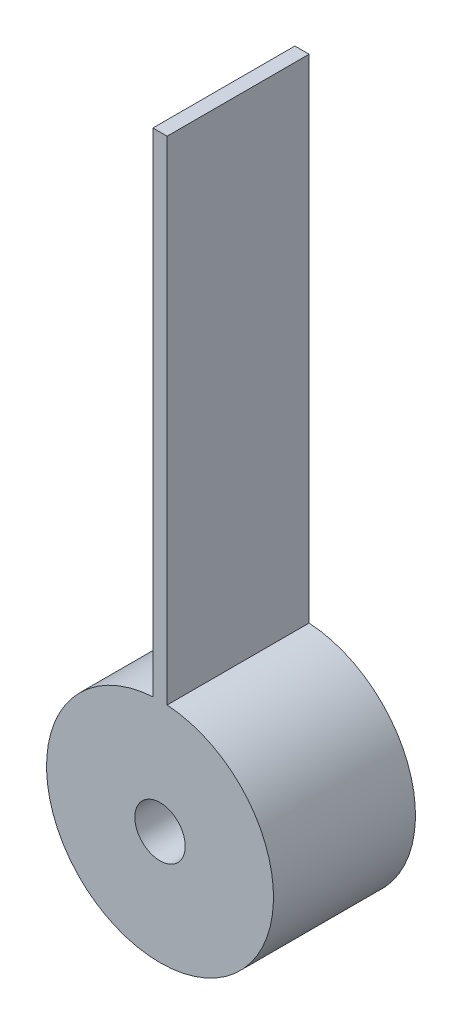
from build123d import *

# Parameters (mm, degrees)
EXTRUDE_1_DEPTH = 10


with BuildPart() as part:
    # Model → 凸台-拉伸1 (new body)
    # profile 1 of 8: a face of its own
    with BuildSketch(Plane.XY):
        with BuildLine():
            ThreePointArc((84.515747624, 134.670602669), (84.656484575, 136.354704261), (86.142958351, 137.15869479))
            Line((86.142958351, 137.15869479), (86.142958351, 143.375196939))
            ThreePointArc((86.142958351, 143.375196939), (85.892835846, 143.371282304), (85.642958351, 143.359542231))
            ThreePointArc((85.642958351, 143.359542231), (79.336442428, 139.572267895), (78.795813778, 132.235830705))
            add(Edge.make_bspline(
                [(78.795813778, 132.235830705), (79.201442186, 132.418540823), (79.597751424, 132.591555239), (80.43048274, 132.949140202), (80.863351604, 133.131140862), (82.114964313, 133.6560009), (82.926668954, 133.99465917), (83.986978139, 134.444262968), (84.25259172, 134.55751775), (84.515747624, 134.670602669)],
                knots=[239.817826964, 239.817826964, 239.817826964, 239.817826964, 241.118324831, 241.118324831, 242.624871419, 242.624871419, 245.637964594, 245.637964594, 246.657264609, 246.657264609, 246.657264609, 246.657264609], degree=3))
        make_face()
    # profile 2 of 8: a face of its own
    with BuildSketch(Plane.XY):
        with BuildLine():
            Line((86.142958351, 143.375196939), (86.142958351, 137.15869479))
            ThreePointArc((86.142958351, 137.15869479), (87.108905296, 136.873065368), (87.764175911, 136.108043742))
            add(Edge.make_bspline(
                [(87.764175911, 136.108043742), (88.044686421, 136.233986931), (88.329332122, 136.361475152), (89.512151447, 136.887586955), (90.447565566, 137.295513383), (92.083163303, 137.96177294), (92.753710832, 138.223187829), (93.469726438, 138.48335369), (93.487007878, 138.489621969), (93.504311736, 138.495887208)],
                knots=[0.564975086, 0.564975086, 0.564975086, 0.564975086, 1.587442363, 1.587442363, 4.749752142, 4.749752142, 6.841880027, 6.841880027, 6.893554923, 6.893554923, 6.893554923, 6.893554923], degree=3))
            ThreePointArc((93.504311736, 138.495887208), (90.765079543, 141.903163231), (86.642958351, 143.359542231))
            ThreePointArc((86.642958351, 143.359542231), (86.393080856, 143.371282304), (86.142958351, 143.375196939))
        make_face()
    # profile 3 of 8: a face of its own
    with BuildSketch(Plane.XY):
        with BuildLine():
            ThreePointArc((85.642958351, 143.359542231), (85.892835846, 143.371282304), (86.142958351, 143.375196939))
            Line((86.142958351, 143.375196939), (86.142958351, 178.058382984))
            Line((86.142958351, 178.058382984), (85.642958351, 178.058382984))
            Line((85.642958351, 178.058382984), (85.642958351, 143.359542231))
        make_face()
    # profile 4 of 8: a face of its own
    with BuildSketch(Plane.XY):
        with BuildLine():
            Line((86.142958351, 178.058382984), (86.142958351, 143.375196939))
            ThreePointArc((86.142958351, 143.375196939), (86.393080856, 143.371282304), (86.642958351, 143.359542231))
            Line((86.642958351, 143.359542231), (86.642958351, 178.058382984))
            Line((86.642958351, 178.058382984), (86.142958351, 178.058382984))
        make_face()
    # profile 5 of 8: a face of its own
    with BuildSketch(Plane.XY):
        with BuildLine():
            add(Edge.make_bspline(
                [(87.764175911, 136.108043742), (88.044686421, 136.233986931), (88.329332122, 136.361475152), (89.512151447, 136.887586955), (90.447565566, 137.295513383), (92.083163303, 137.96177294), (92.753710832, 138.223187829), (93.469726438, 138.48335369), (93.487007878, 138.489621969), (93.504311736, 138.495887208)],
                knots=[0.564975086, 0.564975086, 0.564975086, 0.564975086, 1.587442363, 1.587442363, 4.749752142, 4.749752142, 6.841880027, 6.841880027, 6.893554923, 6.893554923, 6.893554923, 6.893554923], degree=3))
            ThreePointArc((87.764175911, 136.108043742), (87.879938578, 135.753476276), (87.919101822, 135.382551319))
            ThreePointArc((87.919101822, 135.382551319), (86.506638101, 133.644039694), (84.515747624, 134.670602669))
            add(Edge.make_bspline(
                [(78.795813778, 132.235830705), (79.201442186, 132.418540823), (79.597751424, 132.591555239), (80.43048274, 132.949140202), (80.863351604, 133.131140862), (82.114964313, 133.6560009), (82.926668954, 133.99465917), (83.986978139, 134.444262968), (84.25259172, 134.55751775), (84.515747624, 134.670602669)],
                knots=[239.817826964, 239.817826964, 239.817826964, 239.817826964, 241.118324831, 241.118324831, 242.624871419, 242.624871419, 245.637964594, 245.637964594, 246.657264609, 246.657264609, 246.657264609, 246.657264609], degree=3))
            ThreePointArc((78.795813778, 132.235830705), (87.749081185, 127.552943829), (94.135603971, 135.382551319))
            ThreePointArc((94.135603971, 135.382551319), (93.976191174, 136.97089875), (93.504311736, 138.495887208))
        make_face()
        with BuildLine():
            Line((88.496502727, 133.902759243), (88.512127727, 133.958314799))
            Line((88.512127727, 133.958314799), (89.343724949, 133.958314799))
            add(Edge.make_bspline(
                [(89.343724949, 133.958314799), (89.366005787, 133.958238455), (89.408980089, 133.958091208), (89.471053535, 133.956776722), (89.528214846, 133.954691019), (89.580306274, 133.951642223), (89.627534592, 133.9479855), (89.669736637, 133.942554801), (89.707184007, 133.937323238), (89.73017603, 133.932393725), (89.740860366, 133.930102993)],
                knots=[0, 0, 0, 0, 1.340730156, 2.585941556, 3.735938728, 4.782417436, 5.725908979, 6.585455251, 7.3426646, 8, 8, 8, 8], degree=3))
            add(Edge.make_bspline(
                [(89.740860366, 133.930102993), (89.765706412, 133.923464048), (89.813724826, 133.910633369), (89.879766264, 133.879782009), (89.937121094, 133.840548316), (89.984372838, 133.792792491), (90.022630996, 133.739889797), (90.049560147, 133.682258653), (90.06727416, 133.621249519), (90.068985126, 133.579098378), (90.069853421, 133.55770716)],
                knots=[0, 0, 0, 0, 1.1444407, 2.211789597, 3.231322223, 4.22529072, 5.191493565, 6.126021885, 7.048977693, 8, 8, 8, 8], degree=3))
            add(Edge.make_bspline(
                [(90.069853421, 133.55770716), (90.068909804, 133.539711572), (90.066994541, 133.503185887), (90.054506044, 133.44816215), (90.032379754, 133.393332999), (90.003916963, 133.338057211), (89.96660929, 133.285016865), (89.920448571, 133.236493922), (89.866039091, 133.192922642), (89.814439589, 133.160967962), (89.76801639, 133.137432734), (89.727972879, 133.120396865), (89.683969739, 133.102912434), (89.635185634, 133.086510324), (89.582232564, 133.070101588), (89.524694533, 133.054211436), (89.463059851, 133.03780512), (89.420153109, 133.028320648), (89.397978421, 133.023418965)],
                knots=[0, 0, 0, 0, 0.926015676, 1.879536179, 2.885868529, 3.961296715, 5.072379891, 6.209732737, 7.395503017, 8.649275246, 9.325055167, 10.071803552, 10.887356143, 11.760683543, 12.718957186, 13.739396155, 14.831694431, 16, 16, 16, 16], degree=3))
            add(Edge.make_bspline(
                [(89.397978421, 133.023418965), (89.42206246, 133.016998306), (89.468651614, 133.00457792), (89.535067023, 132.982763634), (89.595715409, 132.95982056), (89.651100787, 132.936143224), (89.700227585, 132.910105818), (89.744019154, 132.88338132), (89.781886478, 132.854956525), (89.814050432, 132.824870327), (89.84187059, 132.793564633), (89.865689713, 132.761145878), (89.885826791, 132.727400518), (89.902526046, 132.692622975), (89.915086126, 132.656311611), (89.924115105, 132.618958092), (89.930145032, 132.580326591), (89.930688233, 132.554113403), (89.930964532, 132.540780076)],
                knots=[0, 0, 0, 0, 1.531555644, 2.96270413, 4.293681306, 5.516048711, 6.661459008, 7.707599869, 8.666075599, 9.565667882, 10.409627692, 11.23655517, 12.034039933, 12.821499316, 13.603215525, 14.390323465, 15.181238721, 16, 16, 16, 16], degree=3))
            add(Edge.make_bspline(
                [(89.930964532, 132.540780076), (89.930624849, 132.528177306), (89.92994649, 132.503009206), (89.924587774, 132.465179366), (89.915280889, 132.42768631), (89.9032277, 132.389938357), (89.88700207, 132.352716467), (89.867254625, 132.31543414), (89.843812939, 132.2784648), (89.817528115, 132.241608575), (89.788110476, 132.206194712), (89.756210312, 132.172800733), (89.721562196, 132.142334206), (89.685005327, 132.114115641), (89.64647148, 132.087745357), (89.604906283, 132.065034344), (89.561447941, 132.043945869), (89.514368358, 132.025339229), (89.461239324, 132.008793245), (89.399352063, 131.995306447), (89.327899069, 131.98384116), (89.246657378, 131.974383297), (89.155736045, 131.967176307), (89.054848241, 131.962258297), (88.944302551, 131.958502897), (88.867310769, 131.958379194), (88.827231893, 131.958314799)],
                knots=[0, 0, 0, 0, 0.649983419, 1.298035872, 1.965980934, 2.640976837, 3.339692447, 4.057479056, 4.815351188, 5.596173487, 6.391204644, 7.188229986, 7.97597665, 8.768657352, 9.569725703, 10.381602759, 11.209445122, 12.06037968, 12.990438067, 14.076787314, 15.324591579, 16.722421325, 18.294818179, 20.028592824, 21.932642545, 24, 24, 24, 24], degree=3))
            Line((88.827231893, 131.958314799), (87.937040921, 131.958314799))
            Line((87.937040921, 131.958314799), (87.957440227, 132.013870354))
            add(Edge.make_bspline(
                [(87.957440227, 132.013870354), (87.97742018, 132.014006357), (88.014397404, 132.01425806), (88.065230888, 132.01883261), (88.107276247, 132.024531417), (88.141098002, 132.03430147), (88.16901877, 132.046946668), (88.19286513, 132.062820301), (88.214481834, 132.081028857), (88.234102735, 132.103972973), (88.252489424, 132.135057067), (88.271101693, 132.177140141), (88.291189357, 132.23150028), (88.30438723, 132.272063116), (88.311606893, 132.294252299)],
                knots=[0, 0, 0, 0, 1.413684466, 2.616328741, 3.6114587, 4.411948615, 5.099362341, 5.772591528, 6.433556287, 7.094521047, 7.898997588, 8.980549035, 10.348262692, 12, 12, 12, 12], degree=3))
            Line((88.311606893, 132.294252299), (88.686606893, 133.523418965))
            add(Edge.make_bspline(
                [(88.686606893, 133.523418965), (88.691092356, 133.538464662), (88.699711053, 133.567374565), (88.712001207, 133.608636195), (88.721866907, 133.646181737), (88.730508377, 133.679637731), (88.736168228, 133.70945627), (88.741415531, 133.73523107), (88.744065765, 133.75715834), (88.744551035, 133.770520876), (88.744766616, 133.77645716)],
                knots=[0, 0, 0, 0, 1.447737894, 2.781789423, 3.969395032, 5.027424898, 5.966676759, 6.767329987, 7.452388503, 8, 8, 8, 8], degree=3))
            add(Edge.make_bspline(
                [(88.744766616, 133.77645716), (88.744154591, 133.784774328), (88.742938857, 133.801295672), (88.734022406, 133.82476489), (88.718760938, 133.845460846), (88.701810087, 133.860619777), (88.684467991, 133.871410359), (88.667339877, 133.878204886), (88.647188527, 133.884583139), (88.623583927, 133.890341507), (88.596519633, 133.894265038), (88.566331944, 133.898461843), (88.532542139, 133.90073386), (88.508944917, 133.902060003), (88.496502727, 133.902759243)],
                knots=[0, 0, 0, 0, 0.966607597, 1.920083533, 2.872965034, 3.933888757, 4.545873516, 5.239857326, 6.070253167, 7.005125835, 8.062170482, 9.250079418, 10.550039757, 12, 12, 12, 12], degree=3))
        make_face(mode=Mode.SUBTRACT)
    # profile 6 of 8: a face of its own
    with BuildSketch(Plane.XY):
        with BuildLine():
            Line((89.343724949, 133.958314799), (88.512127727, 133.958314799))
            Line((88.512127727, 133.958314799), (88.496502727, 133.902759243))
            add(Edge.make_bspline(
                [(88.744766616, 133.77645716), (88.744154591, 133.784774328), (88.742938857, 133.801295672), (88.734022406, 133.82476489), (88.718760938, 133.845460846), (88.701810087, 133.860619777), (88.684467991, 133.871410359), (88.667339877, 133.878204886), (88.647188527, 133.884583139), (88.623583927, 133.890341507), (88.596519633, 133.894265038), (88.566331944, 133.898461843), (88.532542139, 133.90073386), (88.508944917, 133.902060003), (88.496502727, 133.902759243)],
                knots=[0, 0, 0, 0, 0.966607597, 1.920083533, 2.872965034, 3.933888757, 4.545873516, 5.239857326, 6.070253167, 7.005125835, 8.062170482, 9.250079418, 10.550039757, 12, 12, 12, 12], degree=3))
            add(Edge.make_bspline(
                [(88.686606893, 133.523418965), (88.691092356, 133.538464662), (88.699711053, 133.567374565), (88.712001207, 133.608636195), (88.721866907, 133.646181737), (88.730508377, 133.679637731), (88.736168228, 133.70945627), (88.741415531, 133.73523107), (88.744065765, 133.75715834), (88.744551035, 133.770520876), (88.744766616, 133.77645716)],
                knots=[0, 0, 0, 0, 1.447737894, 2.781789423, 3.969395032, 5.027424898, 5.966676759, 6.767329987, 7.452388503, 8, 8, 8, 8], degree=3))
            Line((88.686606893, 133.523418965), (88.311606893, 132.294252299))
            add(Edge.make_bspline(
                [(87.957440227, 132.013870354), (87.97742018, 132.014006357), (88.014397404, 132.01425806), (88.065230888, 132.01883261), (88.107276247, 132.024531417), (88.141098002, 132.03430147), (88.16901877, 132.046946668), (88.19286513, 132.062820301), (88.214481834, 132.081028857), (88.234102735, 132.103972973), (88.252489424, 132.135057067), (88.271101693, 132.177140141), (88.291189357, 132.23150028), (88.30438723, 132.272063116), (88.311606893, 132.294252299)],
                knots=[0, 0, 0, 0, 1.413684466, 2.616328741, 3.6114587, 4.411948615, 5.099362341, 5.772591528, 6.433556287, 7.094521047, 7.898997588, 8.980549035, 10.348262692, 12, 12, 12, 12], degree=3))
            Line((87.957440227, 132.013870354), (87.937040921, 131.958314799))
            Line((87.937040921, 131.958314799), (88.827231893, 131.958314799))
            add(Edge.make_bspline(
                [(89.930964532, 132.540780076), (89.930624849, 132.528177306), (89.92994649, 132.503009206), (89.924587774, 132.465179366), (89.915280889, 132.42768631), (89.9032277, 132.389938357), (89.88700207, 132.352716467), (89.867254625, 132.31543414), (89.843812939, 132.2784648), (89.817528115, 132.241608575), (89.788110476, 132.206194712), (89.756210312, 132.172800733), (89.721562196, 132.142334206), (89.685005327, 132.114115641), (89.64647148, 132.087745357), (89.604906283, 132.065034344), (89.561447941, 132.043945869), (89.514368358, 132.025339229), (89.461239324, 132.008793245), (89.399352063, 131.995306447), (89.327899069, 131.98384116), (89.246657378, 131.974383297), (89.155736045, 131.967176307), (89.054848241, 131.962258297), (88.944302551, 131.958502897), (88.867310769, 131.958379194), (88.827231893, 131.958314799)],
                knots=[0, 0, 0, 0, 0.649983419, 1.298035872, 1.965980934, 2.640976837, 3.339692447, 4.057479056, 4.815351188, 5.596173487, 6.391204644, 7.188229986, 7.97597665, 8.768657352, 9.569725703, 10.381602759, 11.209445122, 12.06037968, 12.990438067, 14.076787314, 15.324591579, 16.722421325, 18.294818179, 20.028592824, 21.932642545, 24, 24, 24, 24], degree=3))
            add(Edge.make_bspline(
                [(89.397978421, 133.023418965), (89.42206246, 133.016998306), (89.468651614, 133.00457792), (89.535067023, 132.982763634), (89.595715409, 132.95982056), (89.651100787, 132.936143224), (89.700227585, 132.910105818), (89.744019154, 132.88338132), (89.781886478, 132.854956525), (89.814050432, 132.824870327), (89.84187059, 132.793564633), (89.865689713, 132.761145878), (89.885826791, 132.727400518), (89.902526046, 132.692622975), (89.915086126, 132.656311611), (89.924115105, 132.618958092), (89.930145032, 132.580326591), (89.930688233, 132.554113403), (89.930964532, 132.540780076)],
                knots=[0, 0, 0, 0, 1.531555644, 2.96270413, 4.293681306, 5.516048711, 6.661459008, 7.707599869, 8.666075599, 9.565667882, 10.409627692, 11.23655517, 12.034039933, 12.821499316, 13.603215525, 14.390323465, 15.181238721, 16, 16, 16, 16], degree=3))
            add(Edge.make_bspline(
                [(90.069853421, 133.55770716), (90.068909804, 133.539711572), (90.066994541, 133.503185887), (90.054506044, 133.44816215), (90.032379754, 133.393332999), (90.003916963, 133.338057211), (89.96660929, 133.285016865), (89.920448571, 133.236493922), (89.866039091, 133.192922642), (89.814439589, 133.160967962), (89.76801639, 133.137432734), (89.727972879, 133.120396865), (89.683969739, 133.102912434), (89.635185634, 133.086510324), (89.582232564, 133.070101588), (89.524694533, 133.054211436), (89.463059851, 133.03780512), (89.420153109, 133.028320648), (89.397978421, 133.023418965)],
                knots=[0, 0, 0, 0, 0.926015676, 1.879536179, 2.885868529, 3.961296715, 5.072379891, 6.209732737, 7.395503017, 8.649275246, 9.325055167, 10.071803552, 10.887356143, 11.760683543, 12.718957186, 13.739396155, 14.831694431, 16, 16, 16, 16], degree=3))
            add(Edge.make_bspline(
                [(89.740860366, 133.930102993), (89.765706412, 133.923464048), (89.813724826, 133.910633369), (89.879766264, 133.879782009), (89.937121094, 133.840548316), (89.984372838, 133.792792491), (90.022630996, 133.739889797), (90.049560147, 133.682258653), (90.06727416, 133.621249519), (90.068985126, 133.579098378), (90.069853421, 133.55770716)],
                knots=[0, 0, 0, 0, 1.1444407, 2.211789597, 3.231322223, 4.22529072, 5.191493565, 6.126021885, 7.048977693, 8, 8, 8, 8], degree=3))
            add(Edge.make_bspline(
                [(89.343724949, 133.958314799), (89.366005787, 133.958238455), (89.408980089, 133.958091208), (89.471053535, 133.956776722), (89.528214846, 133.954691019), (89.580306274, 133.951642223), (89.627534592, 133.9479855), (89.669736637, 133.942554801), (89.707184007, 133.937323238), (89.73017603, 133.932393725), (89.740860366, 133.930102993)],
                knots=[0, 0, 0, 0, 1.340730156, 2.585941556, 3.735938728, 4.782417436, 5.725908979, 6.585455251, 7.3426646, 8, 8, 8, 8], degree=3))
        make_face()
        with BuildLine():
            Line((88.706138143, 132.072464104), (88.976103421, 132.958314799))
            add(Edge.make_bspline(
                [(89.430964532, 132.644078688), (89.430441852, 132.660330843), (89.429419494, 132.692119925), (89.419600283, 132.738258323), (89.403296389, 132.781320132), (89.381237838, 132.82100225), (89.354471731, 132.856622892), (89.323462753, 132.887050441), (89.288213004, 132.911223027), (89.255407332, 132.926452203), (89.226104751, 132.93524126), (89.200745381, 132.942098979), (89.171785151, 132.946847538), (89.139404255, 132.951470817), (89.103430975, 132.954039215), (89.064108389, 132.956963488), (89.021247777, 132.958043628), (88.991583555, 132.958221813), (88.976103421, 132.958314799)],
                knots=[0, 0, 0, 0, 1.228143642, 2.402238964, 3.548668198, 4.699893356, 5.824967036, 6.90849946, 7.970990416, 9.043411673, 9.628389874, 10.284038706, 11.028969131, 11.846202225, 12.757796755, 13.755882639, 14.828917999, 16, 16, 16, 16], degree=3))
            add(Edge.make_bspline(
                [(88.821155505, 132.06942591), (88.84866324, 132.070042176), (88.90149483, 132.071225781), (88.977653077, 132.079289117), (89.04729144, 132.093510159), (89.110586611, 132.113242321), (89.167457742, 132.138980606), (89.217552738, 132.170698661), (89.261501595, 132.208082635), (89.2979372, 132.251268599), (89.328846354, 132.297584002), (89.356214373, 132.344660624), (89.379460198, 132.392626579), (89.398084458, 132.441483511), (89.412966921, 132.490908205), (89.423483136, 132.541283361), (89.429590579, 132.59242216), (89.430506192, 132.626846468), (89.430964532, 132.644078688)],
                knots=[0, 0, 0, 0, 1.388963014, 2.667654152, 3.861116407, 4.972422251, 6.008704621, 7.003792219, 7.957024742, 8.910257266, 9.846372071, 10.766095332, 11.658099317, 12.534531264, 13.403594638, 14.261813026, 15.129893296, 16, 16, 16, 16], degree=3))
            add(Edge.make_bspline(
                [(88.706138143, 132.072464104), (88.718145002, 132.071986568), (88.740564667, 132.071094895), (88.77168118, 132.070489298), (88.797999092, 132.069228), (88.813920632, 132.069364076), (88.821155505, 132.06942591)],
                knots=[0, 0, 0, 0, 1.253103092, 2.339841935, 3.245611237, 4, 4, 4, 4], degree=3))
        make_face(mode=Mode.SUBTRACT)
        with BuildLine():
            add(Edge.make_bspline(
                [(89.009957588, 133.06942591), (89.040964931, 133.070570593), (89.099755845, 133.07274095), (89.182813, 133.084922643), (89.255836718, 133.10333032), (89.319543098, 133.130145134), (89.374641126, 133.166360577), (89.423580421, 133.211498469), (89.466745908, 133.266282486), (89.502435571, 133.329409773), (89.5315918, 133.395614628), (89.553937743, 133.461398157), (89.567055283, 133.52579051), (89.568934562, 133.568214358), (89.569853421, 133.58895716)],
                knots=[0, 0, 0, 0, 1.296009604, 2.457275658, 3.501521971, 4.436013454, 5.331587176, 6.243103961, 7.207269813, 8.2340209, 9.265443947, 10.227236849, 11.133221619, 12, 12, 12, 12], degree=3))
            Line((89.009957588, 133.06942591), (89.246936755, 133.847203688))
            Line((89.246936755, 133.847203688), (89.322457588, 133.847203688))
            add(Edge.make_bspline(
                [(89.569853421, 133.58895716), (89.569072153, 133.607269528), (89.567569787, 133.642483954), (89.554596876, 133.692552102), (89.533611397, 133.73747673), (89.503783189, 133.776134545), (89.467346373, 133.808286513), (89.423990323, 133.831331138), (89.37493161, 133.845039178), (89.340343061, 133.846465927), (89.322457588, 133.847203688)],
                knots=[0, 0, 0, 0, 1.090928831, 2.09784069, 3.063011639, 4.029725012, 4.990253829, 5.940176499, 6.934881111, 8, 8, 8, 8], degree=3))
        make_face(mode=Mode.SUBTRACT)
    # profile 7 of 8: a face of its own
    with BuildSketch(Plane.XY):
        with BuildLine():
            Line((89.246936755, 133.847203688), (89.009957588, 133.06942591))
            add(Edge.make_bspline(
                [(89.009957588, 133.06942591), (89.040964931, 133.070570593), (89.099755845, 133.07274095), (89.182813, 133.084922643), (89.255836718, 133.10333032), (89.319543098, 133.130145134), (89.374641126, 133.166360577), (89.423580421, 133.211498469), (89.466745908, 133.266282486), (89.502435571, 133.329409773), (89.5315918, 133.395614628), (89.553937743, 133.461398157), (89.567055283, 133.52579051), (89.568934562, 133.568214358), (89.569853421, 133.58895716)],
                knots=[0, 0, 0, 0, 1.296009604, 2.457275658, 3.501521971, 4.436013454, 5.331587176, 6.243103961, 7.207269813, 8.2340209, 9.265443947, 10.227236849, 11.133221619, 12, 12, 12, 12], degree=3))
            add(Edge.make_bspline(
                [(89.569853421, 133.58895716), (89.569072153, 133.607269528), (89.567569787, 133.642483954), (89.554596876, 133.692552102), (89.533611397, 133.73747673), (89.503783189, 133.776134545), (89.467346373, 133.808286513), (89.423990323, 133.831331138), (89.37493161, 133.845039178), (89.340343061, 133.846465927), (89.322457588, 133.847203688)],
                knots=[0, 0, 0, 0, 1.090928831, 2.09784069, 3.063011639, 4.029725012, 4.990253829, 5.940176499, 6.934881111, 8, 8, 8, 8], degree=3))
            Line((89.322457588, 133.847203688), (89.246936755, 133.847203688))
        make_face()
    # profile 8 of 8: a face of its own
    with BuildSketch(Plane.XY):
        with BuildLine():
            add(Edge.make_bspline(
                [(89.430964532, 132.644078688), (89.430441852, 132.660330843), (89.429419494, 132.692119925), (89.419600283, 132.738258323), (89.403296389, 132.781320132), (89.381237838, 132.82100225), (89.354471731, 132.856622892), (89.323462753, 132.887050441), (89.288213004, 132.911223027), (89.255407332, 132.926452203), (89.226104751, 132.93524126), (89.200745381, 132.942098979), (89.171785151, 132.946847538), (89.139404255, 132.951470817), (89.103430975, 132.954039215), (89.064108389, 132.956963488), (89.021247777, 132.958043628), (88.991583555, 132.958221813), (88.976103421, 132.958314799)],
                knots=[0, 0, 0, 0, 1.228143642, 2.402238964, 3.548668198, 4.699893356, 5.824967036, 6.90849946, 7.970990416, 9.043411673, 9.628389874, 10.284038706, 11.028969131, 11.846202225, 12.757796755, 13.755882639, 14.828917999, 16, 16, 16, 16], degree=3))
            Line((88.976103421, 132.958314799), (88.706138143, 132.072464104))
            add(Edge.make_bspline(
                [(88.706138143, 132.072464104), (88.718145002, 132.071986568), (88.740564667, 132.071094895), (88.77168118, 132.070489298), (88.797999092, 132.069228), (88.813920632, 132.069364076), (88.821155505, 132.06942591)],
                knots=[0, 0, 0, 0, 1.253103092, 2.339841935, 3.245611237, 4, 4, 4, 4], degree=3))
            add(Edge.make_bspline(
                [(88.821155505, 132.06942591), (88.84866324, 132.070042176), (88.90149483, 132.071225781), (88.977653077, 132.079289117), (89.04729144, 132.093510159), (89.110586611, 132.113242321), (89.167457742, 132.138980606), (89.217552738, 132.170698661), (89.261501595, 132.208082635), (89.2979372, 132.251268599), (89.328846354, 132.297584002), (89.356214373, 132.344660624), (89.379460198, 132.392626579), (89.398084458, 132.441483511), (89.412966921, 132.490908205), (89.423483136, 132.541283361), (89.429590579, 132.59242216), (89.430506192, 132.626846468), (89.430964532, 132.644078688)],
                knots=[0, 0, 0, 0, 1.388963014, 2.667654152, 3.861116407, 4.972422251, 6.008704621, 7.003792219, 7.957024742, 8.910257266, 9.846372071, 10.766095332, 11.658099317, 12.534531264, 13.403594638, 14.261813026, 15.129893296, 16, 16, 16, 16], degree=3))
        make_face()
    extrude(amount=EXTRUDE_1_DEPTH)


solid = part.part
